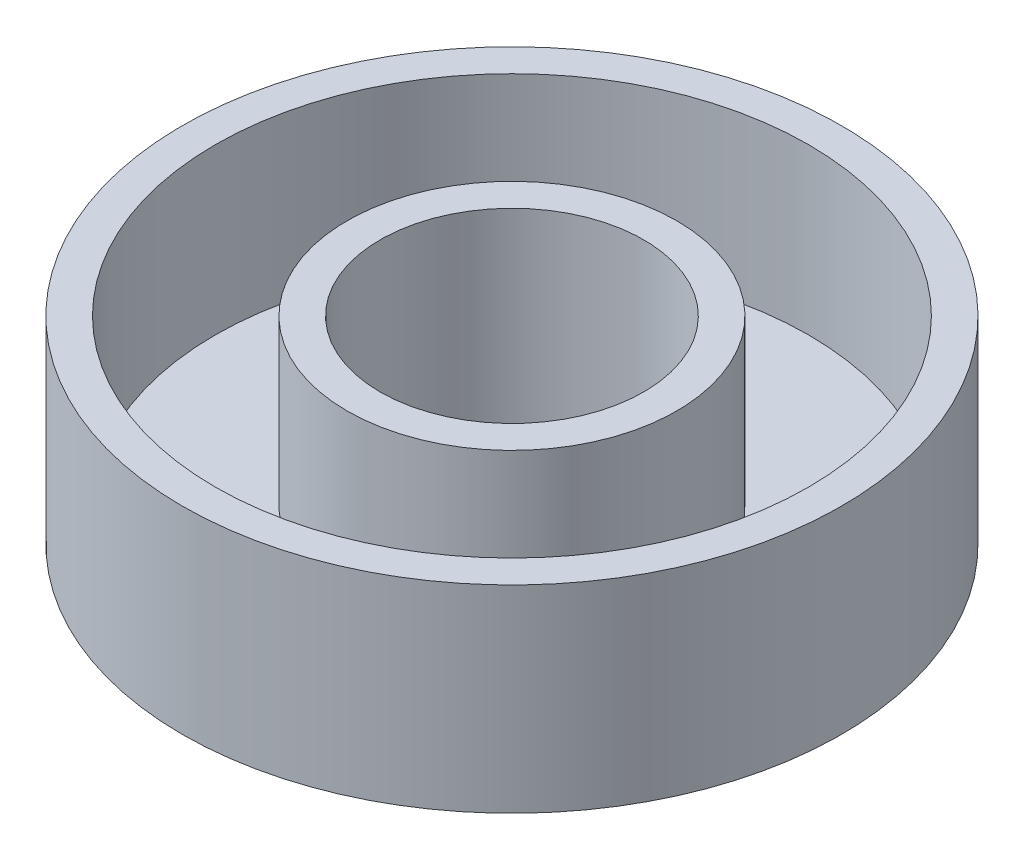
from build123d import *

# Parameters (mm, degrees)
SKETCH1_R            = 10
MAIN_EXTRUSION_DEPTH = 6
SKETCH2_R            = 4
ID_BORE_DEPTH        = 20
SKETCH3_R            = 9
SKETCH3_R_2          = 5
SEAL_RECESS_DEPTH    = 5


with BuildPart() as part:
    # Sketch1 → main extrusion (new body)
    with BuildSketch(Plane(origin=(0, 0, 0), x_dir=(1, 0, 0), z_dir=(0, 1, 0))):
        with Locations(Location((0, 0, 0), (0, 0, 270))):
            Circle(SKETCH1_R)
    extrude(amount=MAIN_EXTRUSION_DEPTH)

    # Sketch2 → ID bore (cut)
    with BuildSketch(Plane(origin=(0, 6, 0), x_dir=(1, 0, 0), z_dir=(0, 1, 0))):
        with Locations(Location((0, 0, 0), (0, 0, 270))):
            Circle(SKETCH2_R)
    extrude(amount=-ID_BORE_DEPTH, mode=Mode.SUBTRACT)

    # Sketch3 → seal recess (cut)
    with BuildSketch(Plane(origin=(0, 6, 0), x_dir=(1, 0, 0), z_dir=(0, 1, 0))):
        with Locations(Location((0, 0, 0), (0, 0, 270))):
            Circle(SKETCH3_R)
        with Locations(Location((0, 0, 0), (0, 0, 270))):
            Circle(SKETCH3_R_2, mode=Mode.SUBTRACT)
    extrude(amount=-SEAL_RECESS_DEPTH, mode=Mode.SUBTRACT)


solid = part.part
